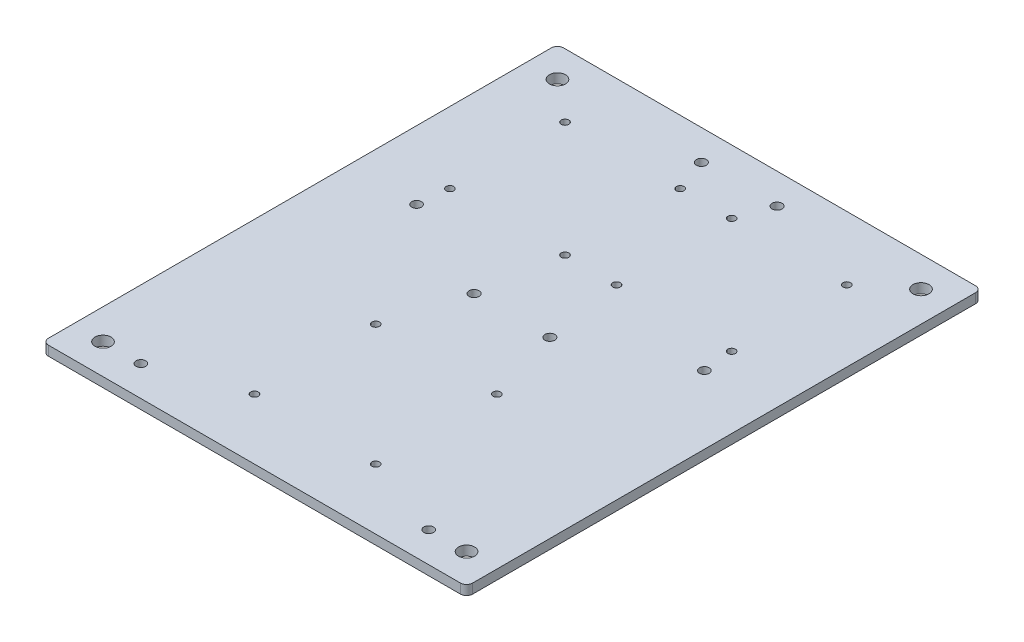
from build123d import *

# Parameters (mm, degrees)
SKETCH1_W             = 140
SKETCH1_H             = 170
BOSS_EXTRUDE1_DEPTH   = 3.175
M3X0_5_TAPPED_HOLE1_D = 2.5
M3_CLEARANCE_HOLE1_D  = 3.2
M4X0_7_TAPPED_HOLE2_D = 3.3
M5_CLEARANCE_HOLE2_D  = 5.3
FILLET1_R             = 2


with BuildPart() as part:
    # Sketch1 → Boss-Extrude1 (new body)
    with BuildSketch(Plane(origin=(0, 0, 0), x_dir=(1, 0, 0), z_dir=(0, 1, 0))):
        Rectangle(SKETCH1_W, SKETCH1_H)
    extrude(amount=BOSS_EXTRUDE1_DEPTH)

    # M3x0.5 Tapped Hole1 (through all)
    with Locations(Plane(origin=(0, 3.175, 0), x_dir=(1, 0, 0), z_dir=(0, 1, 0))):
        with Locations((-46.5, 64), (-46.5, 26), (-8.5, 26), (-8.5, 64), (8.5, 64), (46.5, 64), (8.5, 26), (46.5, 26), (-20, -25), (20, -25), (-20, -65), (20, -65)):
            Hole(M3X0_5_TAPPED_HOLE1_D / 2)

    # M3 Clearance Hole1 (through all)
    with Locations(Plane(origin=(0, 3.175, 0), x_dir=(1, 0, 0), z_dir=(0, 1, 0))):
        with Locations((-47.5, 16), (47.5, 16), (47.5, -75), (-47.5, -75)):
            Hole(M3_CLEARANCE_HOLE1_D / 2)

    # M4x0.7 Tapped Hole2 (through all)
    with Locations(Plane(origin=(0, 3.175, 0), x_dir=(1, 0, 0), z_dir=(0, 1, 0))):
        with Locations((-12.5, 75), (12.5, 75), (-12.5, 0), (12.5, 0)):
            Hole(M4X0_7_TAPPED_HOLE2_D / 2)

    # M5 Clearance Hole2 (through all)
    with Locations(Plane(origin=(0, 3.175, 0), x_dir=(1, 0, 0), z_dir=(0, 1, 0))):
        with Locations((-60, 75), (60, 75), (-60, -75), (60, -75)):
            Hole(M5_CLEARANCE_HOLE2_D / 2)

    # Fillet1
    fillet1_edges = [part.edges().sort_by_distance(p)[0] for p in [
        (70, 1.5875, 85),
        (-70, 1.5875, 85),
        (-70, 1.5875, -85),
        (70, 1.5875, -85),
    ]]
    fillet(fillet1_edges, radius=FILLET1_R)


solid = part.part
